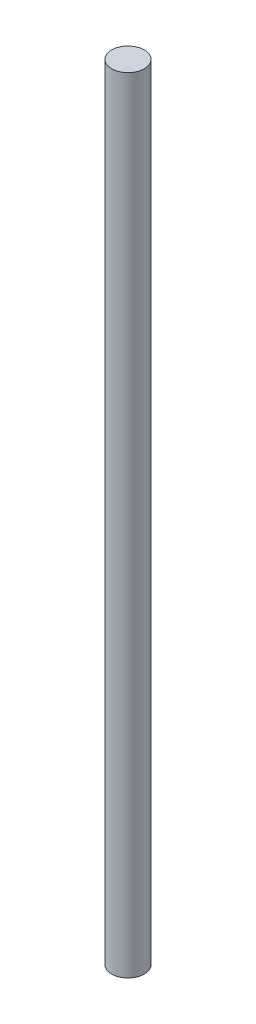
from build123d import *

# Parameters (mm, degrees)
SKETCH_1_R      = 5
EXTRUDE_1_DEPTH = 240


with BuildPart() as part:
    # Эскиз1 → Вытянуть1 (new body)
    with BuildSketch(Plane(origin=(0, 0, 0), x_dir=(1, 0, 0), z_dir=(0, 1, 0))):
        with Locations(Location((0, 0, 0), (0, 0, 270))):
            Circle(SKETCH_1_R)
    extrude(amount=EXTRUDE_1_DEPTH)


solid = part.part
